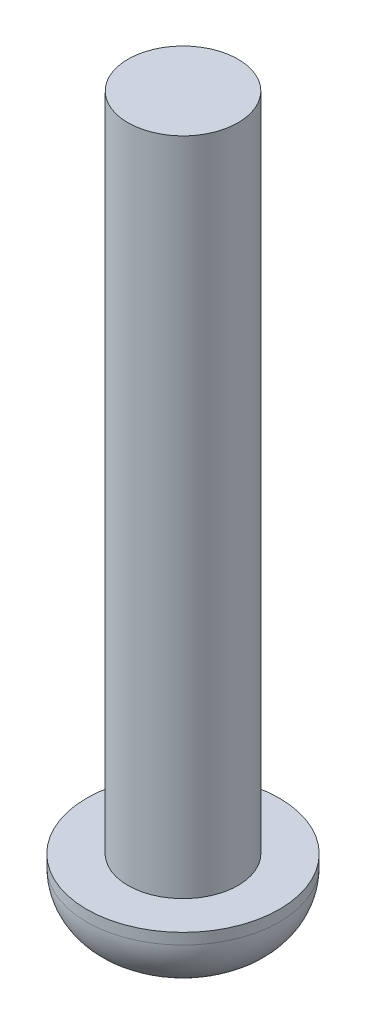
from build123d import *

# Parameters (mm, degrees)
SKETCH_1_R      = 1.75
EXTRUDE_1_DEPTH = 1.2
SKETCH_2_R      = 1
EXTRUDE_2_DEPTH = 12
FILLET_1_R      = 1


with BuildPart() as part:
    # 스케치1 → 보스-돌출1 (new body)
    with BuildSketch(Plane(origin=(0, 0, 0), x_dir=(1, 0, 0), z_dir=(0, 1, 0))):
        with Locations(Location((0, 0, 0), (0, 0, 270))):
            Circle(SKETCH_1_R)
    extrude(amount=EXTRUDE_1_DEPTH)

    # 스케치2 → 보스-돌출2 (add)
    with BuildSketch(Plane(origin=(0, 1.2, 0), x_dir=(1, 0, 0), z_dir=(0, 1, 0))):
        with Locations(Location((0, 0, 0), (0, 0, 270))):
            Circle(SKETCH_2_R)
    extrude(amount=EXTRUDE_2_DEPTH)

    # 필렛1
    fillet_1_edges = [part.edges().sort_by_distance(p)[0] for p in [
        (0, 0, -1.75),
    ]]
    fillet(fillet_1_edges, radius=FILLET_1_R)


solid = part.part
